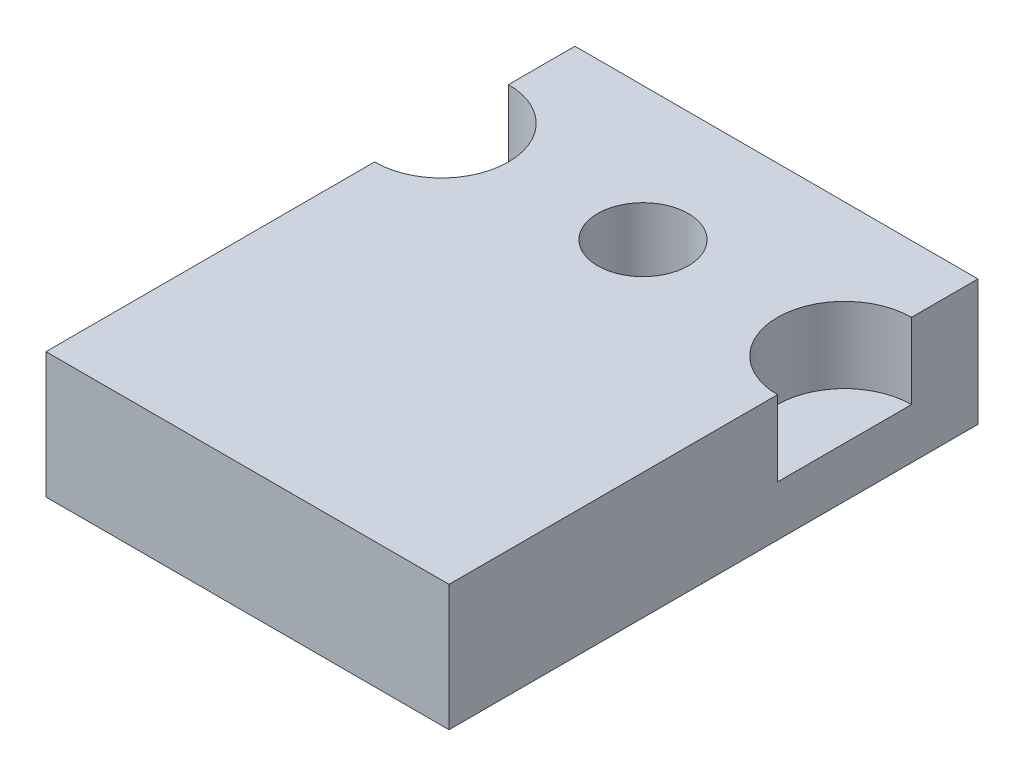
from build123d import *

# Parameters (mm, degrees)
SKETCH1_W           = 16
SKETCH1_H           = 21
SKETCH1_R           = 1.8
BOSS_EXTRUDE2_DEPTH = 5
SKETCH2_R           = 2.66
CUT_EXTRUDE1_DEPTH  = 3


with BuildPart() as part:
    # Sketch1 → Boss-Extrude2 (new body)
    with BuildSketch(Plane(origin=(0, 0, 0), x_dir=(1, 0, 0), z_dir=(0, 1, 0))):
        Rectangle(SKETCH1_W, SKETCH1_H)
        with Locations(Location((0, 5.2, 0), (0, 0, 270))):
            Circle(SKETCH1_R, mode=Mode.SUBTRACT)
    extrude(amount=BOSS_EXTRUDE2_DEPTH)

    # Sketch2 → Cut-Extrude1 (cut)
    with BuildSketch(Plane(origin=(0, 5, 0), x_dir=(1, 0, 0), z_dir=(0, 1, 0))):
        with Locations((-8, 5.2)):
            Circle(SKETCH2_R)
        with Locations((8, 5.2)):
            Circle(SKETCH2_R)
    extrude(amount=-CUT_EXTRUDE1_DEPTH, mode=Mode.SUBTRACT)


solid = part.part
